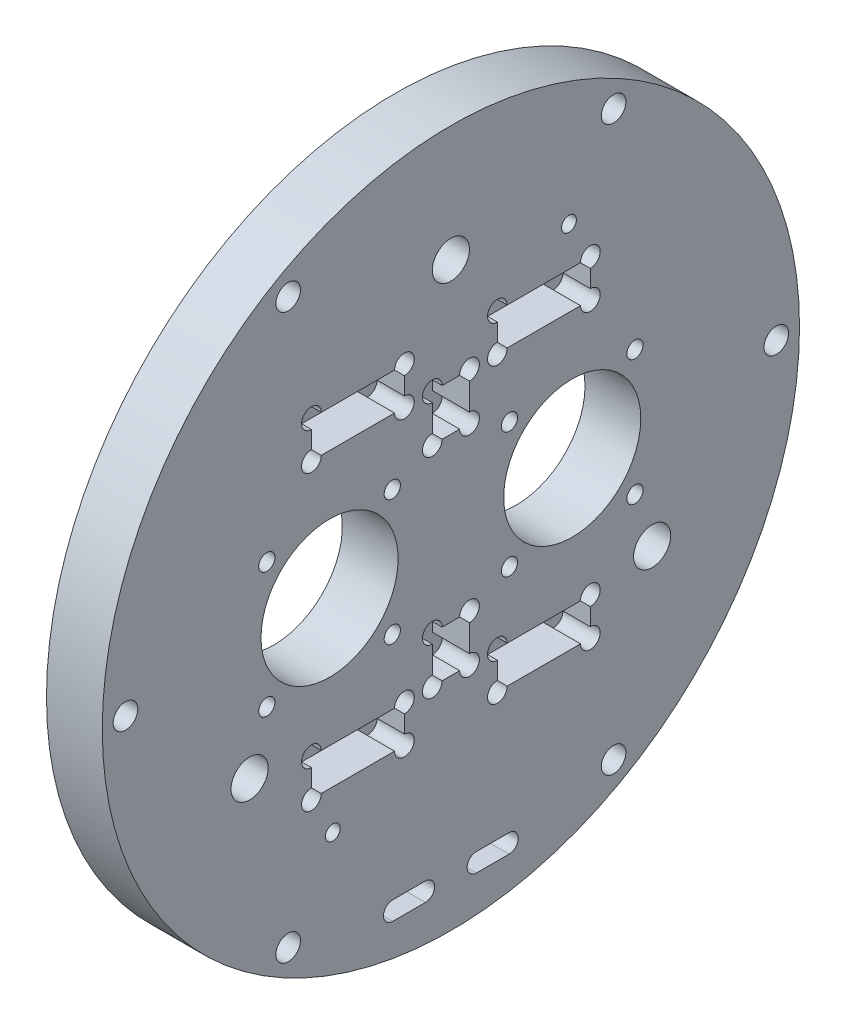
from build123d import *

# Parameters (mm, degrees)
SKETCH1_R           = 75
SKETCH1_R_2         = 4
SKETCH1_R_3         = 14.75
SKETCH1_R_4         = 1.75
BOSS_EXTRUDE1_DEPTH = 12
SKETCH2_W           = 20
SKETCH2_H           = 8
SKETCH2_W_2         = 8
SKETCH2_H_2         = 10
SKETCH2_W_3         = 7
SKETCH2_H_3         = 4
CUT_EXTRUDE1_DEPTH  = 8
CUT_EXTRUDE2_REACH  = 108.743
SKETCH3_R           = 2.65
SKETCH4_R           = 2.121320344
SKETCH4_R_2         = 2
CUT_EXTRUDE3_DEPTH  = 8
CUT_EXTRUDE4_REACH  = 108.743
SKETCH5_R           = 1.6


with BuildPart() as part:
    # Sketch1 → Boss-Extrude1 (new body)
    with BuildSketch(Plane(origin=(0, 0, 0), x_dir=(0, 0, -1), z_dir=(1, 0, 0))):
        Circle(SKETCH1_R)
        with Locations((0, 50)):
            Circle(SKETCH1_R_2, mode=Mode.SUBTRACT)
        with Locations((43.301270189, -25)):
            Circle(SKETCH1_R_2, mode=Mode.SUBTRACT)
        with Locations((-43.301270189, -25)):
            Circle(SKETCH1_R_2, mode=Mode.SUBTRACT)
        with Locations((26.1, 0)):
            Circle(SKETCH1_R_3, mode=Mode.SUBTRACT)
        with Locations(Location((-26.1, 0, 0), (0, 0, 180))):
            Circle(SKETCH1_R_3, mode=Mode.SUBTRACT)
        with Locations((39.596900686, 13.496900686)):
            Circle(SKETCH1_R_4, mode=Mode.SUBTRACT)
        with Locations((39.596900686, -13.496900686)):
            Circle(SKETCH1_R_4, mode=Mode.SUBTRACT)
        with Locations((12.603099314, -13.496900686)):
            Circle(SKETCH1_R_4, mode=Mode.SUBTRACT)
        with Locations((12.603099314, 13.496900686)):
            Circle(SKETCH1_R_4, mode=Mode.SUBTRACT)
        with Locations(Location((-39.596900686, -13.496900686, 0), (0, 0, 180))):
            Circle(SKETCH1_R_4, mode=Mode.SUBTRACT)
        with Locations(Location((-12.603099314, -13.496900686, 0), (0, 0, 180))):
            Circle(SKETCH1_R_4, mode=Mode.SUBTRACT)
        with Locations(Location((-12.603099314, 13.496900686, 0), (0, 0, 180))):
            Circle(SKETCH1_R_4, mode=Mode.SUBTRACT)
        with Locations(Location((-39.596900686, 13.496900686, 0), (0, 0, 180))):
            Circle(SKETCH1_R_4, mode=Mode.SUBTRACT)
    extrude(amount=BOSS_EXTRUDE1_DEPTH)

    # Sketch2 → Cut-Extrude1 (cut)
    with BuildSketch(Plane(origin=(12, 0, 0), x_dir=(0, 0, -1), z_dir=(1, 0, 0))):
        with Locations((20, -31.5)):
            Rectangle(SKETCH2_W, SKETCH2_H)
        with Locations((-20, -31.5)):
            Rectangle(SKETCH2_W, SKETCH2_H)
        with Locations((-20, 31.5)):
            Rectangle(SKETCH2_W, SKETCH2_H)
        with Locations((20, 31.5)):
            Rectangle(SKETCH2_W, SKETCH2_H)
        with Locations((0, -22.5)):
            Rectangle(SKETCH2_W_2, SKETCH2_H_2)
        with Locations((0, 22.5)):
            Rectangle(SKETCH2_W_2, SKETCH2_H_2)
        with Locations((-9, -65)):
            Rectangle(SKETCH2_W_3, SKETCH2_H_3)
        with Locations((9, -65)):
            Rectangle(SKETCH2_W_3, SKETCH2_H_3)
    extrude(amount=-CUT_EXTRUDE1_DEPTH, mode=Mode.SUBTRACT)

    # Sketch3 → Cut-Extrude2 (cut, up to next)
    with BuildSketch(Plane.ZY, mode=Mode.PRIVATE) as cut_extrude2_sk1:
        with Locations((-70, 0)):
            Circle(SKETCH3_R)
    cut_extrude2_tool1 = extrude(cut_extrude2_sk1.sketch, amount=-CUT_EXTRUDE2_REACH, mode=Mode.PRIVATE) & part.part
    # Sketch3 → Cut-Extrude2 (cut, up to next)
    with BuildSketch(Plane.ZY, mode=Mode.PRIVATE) as cut_extrude2_sk2:
        with Locations((-35, 60.621778265)):
            Circle(SKETCH3_R)
    cut_extrude2_tool2 = extrude(cut_extrude2_sk2.sketch, amount=-CUT_EXTRUDE2_REACH, mode=Mode.PRIVATE) & part.part
    # Sketch3 → Cut-Extrude2 (cut, up to next)
    with BuildSketch(Plane.ZY, mode=Mode.PRIVATE) as cut_extrude2_sk3:
        with Locations((35, 60.621778265)):
            Circle(SKETCH3_R)
    cut_extrude2_tool3 = extrude(cut_extrude2_sk3.sketch, amount=-CUT_EXTRUDE2_REACH, mode=Mode.PRIVATE) & part.part
    # Sketch3 → Cut-Extrude2 (cut, up to next)
    with BuildSketch(Plane.ZY, mode=Mode.PRIVATE) as cut_extrude2_sk4:
        with Locations((70, 0)):
            Circle(SKETCH3_R)
    cut_extrude2_tool4 = extrude(cut_extrude2_sk4.sketch, amount=-CUT_EXTRUDE2_REACH, mode=Mode.PRIVATE) & part.part
    # Sketch3 → Cut-Extrude2 (cut, up to next)
    with BuildSketch(Plane.ZY, mode=Mode.PRIVATE) as cut_extrude2_sk5:
        with Locations((35, -60.621778265)):
            Circle(SKETCH3_R)
    cut_extrude2_tool5 = extrude(cut_extrude2_sk5.sketch, amount=-CUT_EXTRUDE2_REACH, mode=Mode.PRIVATE) & part.part
    # Sketch3 → Cut-Extrude2 (cut, up to next)
    with BuildSketch(Plane.ZY, mode=Mode.PRIVATE) as cut_extrude2_sk6:
        with Locations((-35, -60.621778265)):
            Circle(SKETCH3_R)
    cut_extrude2_tool6 = extrude(cut_extrude2_sk6.sketch, amount=-CUT_EXTRUDE2_REACH, mode=Mode.PRIVATE) & part.part
    add(cut_extrude2_tool1.solids().sort_by_distance((0, 0, -70))[0], mode=Mode.SUBTRACT)
    add(cut_extrude2_tool2.solids().sort_by_distance((0, 60.621778, -35))[0], mode=Mode.SUBTRACT)
    add(cut_extrude2_tool3.solids().sort_by_distance((0, 60.621778, 35))[0], mode=Mode.SUBTRACT)
    add(cut_extrude2_tool4.solids().sort_by_distance((0, 0, 70))[0], mode=Mode.SUBTRACT)
    add(cut_extrude2_tool5.solids().sort_by_distance((0, -60.621778, 35))[0], mode=Mode.SUBTRACT)
    add(cut_extrude2_tool6.solids().sort_by_distance((0, -60.621778, -35))[0], mode=Mode.SUBTRACT)

    # Sketch4 → Cut-Extrude3 (cut)
    with BuildSketch(Plane(origin=(12, 0, 0), x_dir=(0, 0, -1), z_dir=(1, 0, 0))):
        with Locations((-10, -35.5)):
            Circle(SKETCH4_R)
        with Locations((-10, -27.5)):
            Circle(SKETCH4_R)
        with Locations((-30, -27.5)):
            Circle(SKETCH4_R)
        with Locations((-30, -35.5)):
            Circle(SKETCH4_R)
        with Locations((12.5, -65)):
            Circle(SKETCH4_R_2)
        with Locations((5.5, -65)):
            Circle(SKETCH4_R_2)
        with Locations((-5.5, -65)):
            Circle(SKETCH4_R_2)
        with Locations((-12.5, -65)):
            Circle(SKETCH4_R_2)
        with Locations((10, -35.5)):
            Circle(SKETCH4_R)
        with Locations((10, -27.5)):
            Circle(SKETCH4_R)
        with Locations((30, -27.5)):
            Circle(SKETCH4_R)
        with Locations((30, -35.5)):
            Circle(SKETCH4_R)
        with Locations((4, -27.5)):
            Circle(SKETCH4_R)
        with Locations((-4, -27.5)):
            Circle(SKETCH4_R)
        with Locations((-4, -17.5)):
            Circle(SKETCH4_R)
        with Locations((4, -17.5)):
            Circle(SKETCH4_R)
        with Locations((4, 27.5)):
            Circle(SKETCH4_R)
        with Locations((-4, 27.5)):
            Circle(SKETCH4_R)
        with Locations((-4, 17.5)):
            Circle(SKETCH4_R)
        with Locations((4, 17.5)):
            Circle(SKETCH4_R)
        with Locations((10, 27.5)):
            Circle(SKETCH4_R)
        with Locations((10, 35.5)):
            Circle(SKETCH4_R)
        with Locations((30, 35.5)):
            Circle(SKETCH4_R)
        with Locations((30, 27.5)):
            Circle(SKETCH4_R)
        with Locations((-10, 35.5)):
            Circle(SKETCH4_R)
        with Locations((-10, 27.5)):
            Circle(SKETCH4_R)
        with Locations((-30, 27.5)):
            Circle(SKETCH4_R)
        with Locations((-30, 35.5)):
            Circle(SKETCH4_R)
    extrude(amount=-CUT_EXTRUDE3_DEPTH, mode=Mode.SUBTRACT)

    # Sketch5 → Cut-Extrude4 (cut, up to next)
    with BuildSketch(Plane.ZY, mode=Mode.PRIVATE) as cut_extrude4_sk1:
        with Locations((25.403411844, -44)):
            Circle(SKETCH5_R)
    cut_extrude4_tool1 = extrude(cut_extrude4_sk1.sketch, amount=-CUT_EXTRUDE4_REACH, mode=Mode.PRIVATE) & part.part
    # Sketch5 → Cut-Extrude4 (cut, up to next)
    with BuildSketch(Plane.ZY, mode=Mode.PRIVATE) as cut_extrude4_sk2:
        with Locations((-25.403411844, 44)):
            Circle(SKETCH5_R)
    cut_extrude4_tool2 = extrude(cut_extrude4_sk2.sketch, amount=-CUT_EXTRUDE4_REACH, mode=Mode.PRIVATE) & part.part
    add(cut_extrude4_tool1.solids().sort_by_distance((0, -44, 25.403412))[0], mode=Mode.SUBTRACT)
    add(cut_extrude4_tool2.solids().sort_by_distance((0, 44, -25.403412))[0], mode=Mode.SUBTRACT)


solid = part.part
